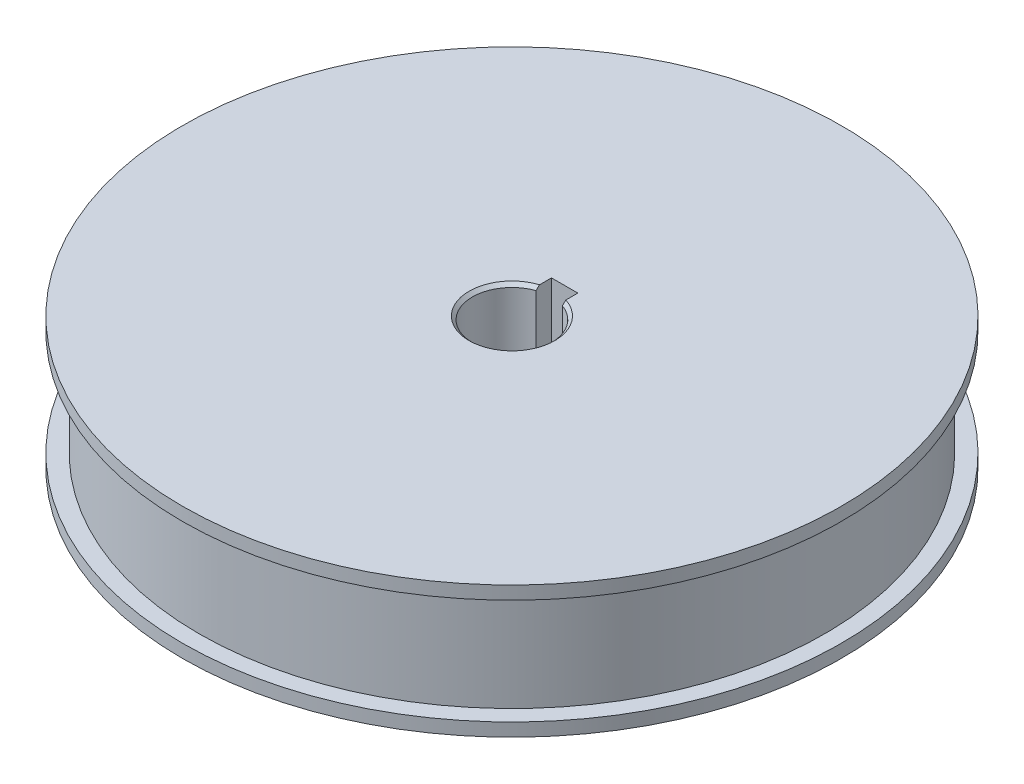
from build123d import *

# Parameters (mm, degrees)
SKETCH_1_R          = 50
EXTRUDE_1_DEPTH     = 20
CUT_EXTRUDE_START   = -18
SKETCH_2_R          = 50
SKETCH_2_R_2        = 47.5
CUT_EXTRUDE_1_DEPTH = 16
SKETCH_3_R          = 6
CUT_EXTRUDE_2_DEPTH = 74.484692283
CHAMFER_1_SIZE      = 0.5
SKETCH_4_W          = 4
SKETCH_4_H          = 8.342964167
CUT_EXTRUDE_3_DEPTH = 74.484692283


with BuildPart() as part:
    # 草图1 → 凸台-拉伸1 (new body)
    with BuildSketch(Plane(origin=(0, 0, 0), x_dir=(1, 0, 0), z_dir=(0, 1, 0))):
        with Locations(Location((0, 0, 0), (0, 0, 270))):
            Circle(SKETCH_1_R)
    extrude(amount=EXTRUDE_1_DEPTH)

    # 草图2 → 切除-拉伸1 (cut)
    with BuildSketch(Plane(origin=(0, 20, 0), x_dir=(1, 0, 0), z_dir=(0, 1, 0)).offset(CUT_EXTRUDE_START)):
        with Locations(Location((0, 0, 0), (0, 0, 270))):
            Circle(SKETCH_2_R)
        with Locations(Location((0, 0, 0), (0, 0, 270))):
            Circle(SKETCH_2_R_2, mode=Mode.SUBTRACT)
    extrude(amount=CUT_EXTRUDE_1_DEPTH, mode=Mode.SUBTRACT)

    # 草图3 → 切除-拉伸2 (cut, through all)
    with BuildSketch(Plane(origin=(0, 20, 0), x_dir=(1, 0, 0), z_dir=(0, 1, 0))):
        with Locations(Location((0, 0, 0), (0, 0, 270))):
            Circle(SKETCH_3_R)
    extrude(amount=-CUT_EXTRUDE_2_DEPTH, mode=Mode.SUBTRACT)

    # 倒角1
    chamfer_1_edges = [part.edges().sort_by_distance(p)[0] for p in [
        (0, 0, -6),
        (0, 20, -6),
    ]]
    chamfer(chamfer_1_edges, length=CHAMFER_1_SIZE)

    # 草图4 → 切除-拉伸3 (cut, through all)
    with BuildSketch(Plane(origin=(0, 20, 0), x_dir=(1, 0, 0), z_dir=(0, 1, 0))):
        with Locations((0, 3.828517917)):
            Rectangle(SKETCH_4_W, SKETCH_4_H)
    extrude(amount=-CUT_EXTRUDE_3_DEPTH, mode=Mode.SUBTRACT)


solid = part.part
